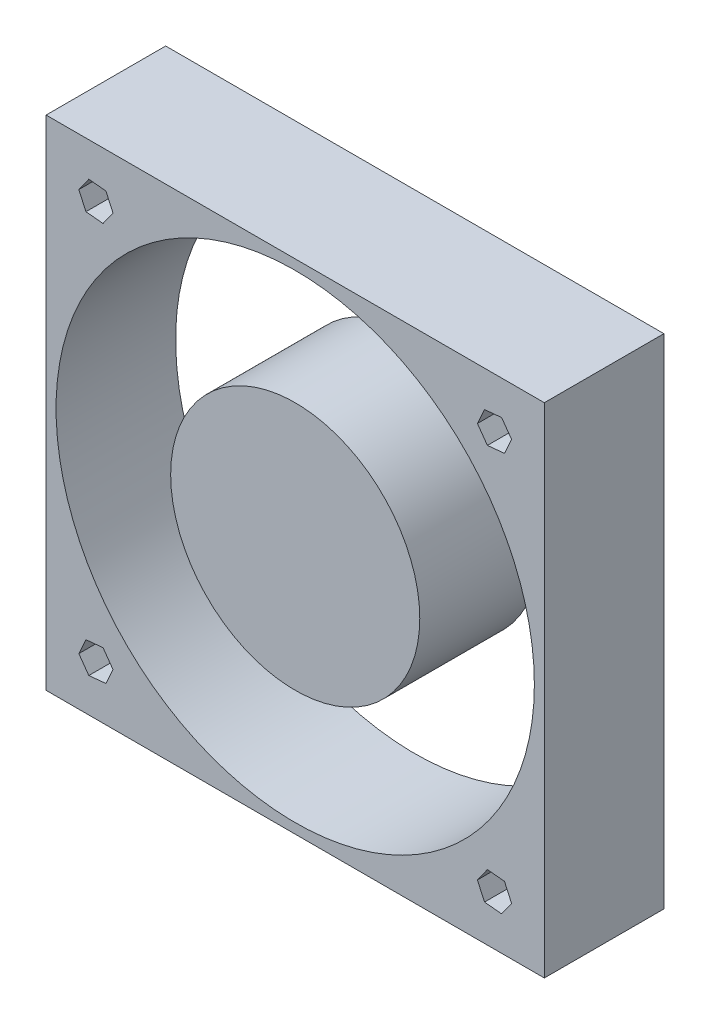
from build123d import *

# Parameters (mm, degrees)
SKETCH_1_W          = 50
SKETCH_1_H          = 50
EXTRUDE_1_DEPTH     = 12
SKETCH_2_R          = 24
SKETCH_2_R_2        = 12.5
CUT_EXTRUDE_1_DEPTH = 38.336309405
CUT_EXTRUDE_2_DEPTH = 10
SKETCH_4_R          = 1
CUT_EXTRUDE_3_DEPTH = 38.336309405


with BuildPart() as part:
    # 草图1 → 凸台-拉伸1 (new body)
    with BuildSketch(Plane.XY):
        Rectangle(SKETCH_1_W, SKETCH_1_H)
    extrude(amount=EXTRUDE_1_DEPTH)

    # 草图2 → 切除-拉伸1 (cut, through all)
    with BuildSketch(Plane.XY.offset(12)):
        Circle(SKETCH_2_R)
        Circle(SKETCH_2_R_2, mode=Mode.SUBTRACT)
    extrude(amount=-CUT_EXTRUDE_1_DEPTH, mode=Mode.SUBTRACT)


with BuildPart() as cut_extrude_1_piece_1:
    # of the separate pieces the step leaves, piece 1, a body of its own (cut_extrude_1_pieces)
    add(part.part.solids().sort_by_distance((-25, 25, 0))[0])

    # 草图3 → 切除-拉伸2 (cut)
    with BuildSketch(Plane.XY.offset(12)):
        Polygon((-18.998434457, 21.40219176), (-20.713550914, 21.568477084), (-21.715116456, 20.166285324), (-21.001565543, 18.59780824), (-19.286449086, 18.431522916), (-18.284883544, 19.833714676), align=None)
        Polygon((-18.284883544, -19.833714676), (-18.998434457, -21.40219176), (-20.713550914, -21.568477084), (-21.715116456, -20.166285324), (-21.001565543, -18.59780824), (-19.286449086, -18.431522916), align=None)
        Polygon((18.998434457, -21.40219176), (20.713550914, -21.568477084), (21.715116456, -20.166285324), (21.001565543, -18.59780824), (19.286449086, -18.431522916), (18.284883544, -19.833714676), align=None)
        Polygon((18.284883544, 19.833714676), (18.998434457, 21.40219176), (20.713550914, 21.568477084), (21.715116456, 20.166285324), (21.001565543, 18.59780824), (19.286449086, 18.431522916), align=None)
    extrude(amount=-CUT_EXTRUDE_2_DEPTH, mode=Mode.SUBTRACT)

    # 草图4 → 切除-拉伸3 (cut, through all)
    with BuildSketch(Plane.XY.offset(12)):
        with Locations((-20, 20)):
            Circle(SKETCH_4_R)
        with Locations(Location((-20, -20, 0), (0, 0, 180))):
            Circle(SKETCH_4_R)
        with Locations((20, -20)):
            Circle(SKETCH_4_R)
        with Locations(Location((20, 20, 0), (0, 0, 180))):
            Circle(SKETCH_4_R)
    extrude(amount=-CUT_EXTRUDE_3_DEPTH, mode=Mode.SUBTRACT)


with BuildPart() as cut_extrude_1_piece_2:
    # of the separate pieces the step leaves, piece 2, a body of its own (cut_extrude_1_pieces)
    add(part.part.solids().sort_by_distance((12.5, 0, 0))[0])


solid = Compound([cut_extrude_1_piece_1.part, cut_extrude_1_piece_2.part])
